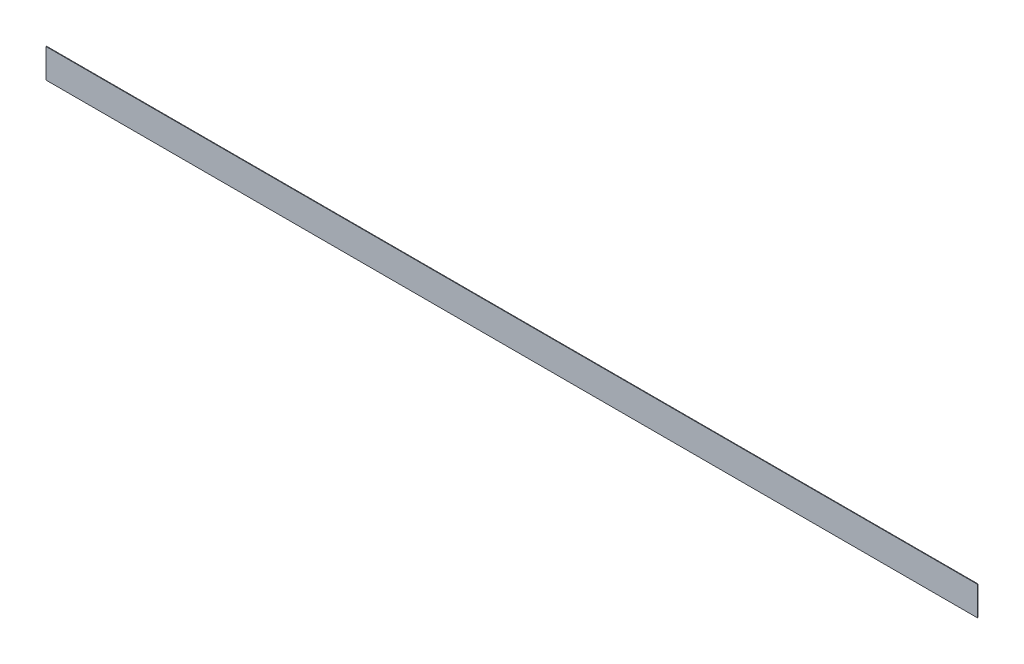
from build123d import *

# Parameters (mm, degrees)
SKETCH1_W           = 160
SKETCH1_H           = 5
BOSS_EXTRUDE1_DEPTH = 0.1


with BuildPart() as part:
    # Sketch1 → Boss-Extrude1 (new body)
    with BuildSketch(Plane.XY):
        with Locations((80, -2.5)):
            Rectangle(SKETCH1_W, SKETCH1_H)
    extrude(amount=BOSS_EXTRUDE1_DEPTH)


solid = part.part
